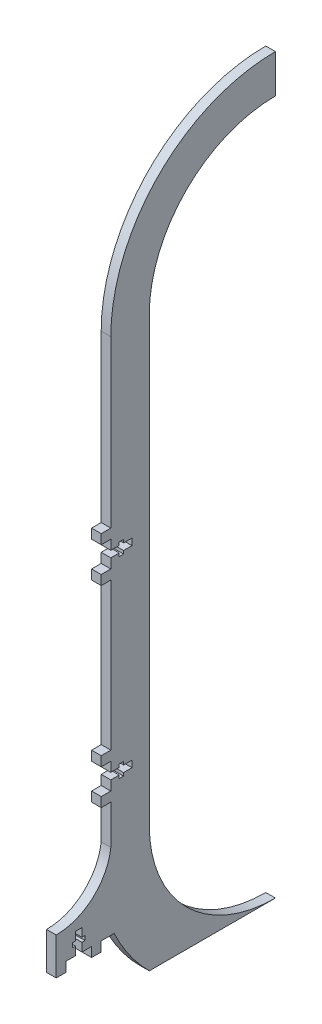
from build123d import *

# Parameters (mm, degrees)
BOSS_EXTRUDE2_DEPTH = 6.35


with BuildPart() as part:
    # Elevator Ball Support Rail → Boss-Extrude2 (new body)
    with BuildSketch(Plane(origin=(0, 0, 0), x_dir=(0, 0, -1), z_dir=(1, 0, 0))):
        with BuildLine():
            ThreePointArc((0, 146.05), (24.401519846, 204.960480154), (83.312, 229.362))
            Line((83.312, 229.362), (83.312, 254.762))
            ThreePointArc((83.312, 254.762), (6.441007604, 222.920992396), (-25.4, 146.05))
            Line((-25.4, 146.05), (-25.4, 36.576))
            Line((-25.4, 36.576), (-31.75, 36.576))
            Line((-31.75, 36.576), (-31.75, 30.226))
            Line((-31.75, 30.226), (-25.4, 30.226))
            Line((-25.4, 30.226), (-25.4, 23.876))
            Line((-25.4, 23.876), (-19.865000021, 23.876))
            Line((-19.865000021, 23.876), (-19.865000021, 25.916999982))
            Line((-19.865000021, 25.916999982), (-16.964999979, 25.916999982))
            Line((-16.964999979, 25.916999982), (-16.964999979, 23.876))
            Line((-16.964999979, 23.876), (-11.43, 23.876))
            Line((-11.43, 23.876), (-11.43, 19.558))
            Line((-11.43, 19.558), (-16.964999979, 19.558))
            Line((-16.964999979, 19.558), (-16.964999979, 17.517000018))
            Line((-16.964999979, 17.517000018), (-19.865000021, 17.517000018))
            Line((-19.865000021, 17.517000018), (-19.865000021, 19.558))
            Line((-19.865000021, 19.558), (-25.4, 19.558))
            Line((-25.4, 19.558), (-25.4, 13.208))
            Line((-25.4, 13.208), (-31.75, 13.208))
            Line((-31.75, 13.208), (-31.75, 6.858))
            Line((-31.75, 6.858), (-25.4, 6.858))
            Line((-25.4, 6.858), (-25.4, -90.424))
            Line((-25.4, -90.424), (-31.75, -90.424))
            Line((-31.75, -90.424), (-31.75, -96.774))
            Line((-31.75, -96.774), (-25.4, -96.774))
            Line((-25.4, -96.774), (-25.4, -103.124))
            Line((-25.4, -103.124), (-19.865000021, -103.124))
            Line((-19.865000021, -103.124), (-19.865000021, -101.083000018))
            Line((-19.865000021, -101.083000018), (-16.964999979, -101.083000018))
            Line((-16.964999979, -101.083000018), (-16.964999979, -103.124))
            Line((-16.964999979, -103.124), (-11.43, -103.124))
            Line((-11.43, -103.124), (-11.43, -107.442))
            Line((-11.43, -107.442), (-16.964999979, -107.442))
            Line((-16.964999979, -107.442), (-16.964999979, -109.482999982))
            Line((-16.964999979, -109.482999982), (-19.865000021, -109.482999982))
            Line((-19.865000021, -109.482999982), (-19.865000021, -107.442))
            Line((-19.865000021, -107.442), (-25.4, -107.442))
            Line((-25.4, -107.442), (-25.4, -113.792))
            Line((-25.4, -113.792), (-31.75, -113.792))
            Line((-31.75, -113.792), (-31.75, -120.142))
            Line((-31.75, -120.142), (-25.4, -120.142))
            Line((-25.4, -120.142), (-25.4, -146.05))
            ThreePointArc((-25.4, -146.05), (-37.346353976, -168.922761976), (-61.468, -178.08926659))
            Line((-61.468, -178.08926659), (-61.468, -196.342))
            Line((-61.468, -196.342), (-61.468, -202.692))
            Line((-61.468, -202.692), (-55.118, -202.692))
            Line((-55.118, -202.692), (-55.118, -196.342))
            Line((-55.118, -196.342), (-48.768, -196.342))
            Line((-48.768, -196.342), (-48.768, -190.807000021))
            Line((-48.768, -190.807000021), (-50.808999982, -190.807000021))
            Line((-50.808999982, -190.807000021), (-50.808999982, -187.906999979))
            Line((-50.808999982, -187.906999979), (-48.768, -187.906999979))
            Line((-48.768, -187.906999979), (-48.768, -182.372))
            Line((-48.768, -182.372), (-44.45, -182.372))
            Line((-44.45, -182.372), (-44.45, -187.906999979))
            Line((-44.45, -187.906999979), (-42.409000018, -187.906999979))
            Line((-42.409000018, -187.906999979), (-42.409000018, -190.807000021))
            Line((-42.409000018, -190.807000021), (-44.45, -190.807000021))
            Line((-44.45, -190.807000021), (-44.45, -196.342))
            Line((-44.45, -196.342), (-38.1, -196.342))
            Line((-38.1, -196.342), (-38.1, -202.692))
            Line((-38.1, -202.692), (-31.75, -202.692))
            Line((-31.75, -202.692), (-31.75, -196.342))
            Line((-31.75, -196.342), (-23.236080339, -196.342))
            ThreePointArc((-23.236080339, -196.342), (-13.043034257, -213.854764297), (0, -229.362))
            Line((0, -229.362), (83.312, -229.362))
            ThreePointArc((83.312, -229.362), (24.401519846, -204.960480154), (0, -146.05))
            Line((0, -146.05), (0, 146.05))
        make_face()
    extrude(amount=BOSS_EXTRUDE2_DEPTH)


solid = part.part
